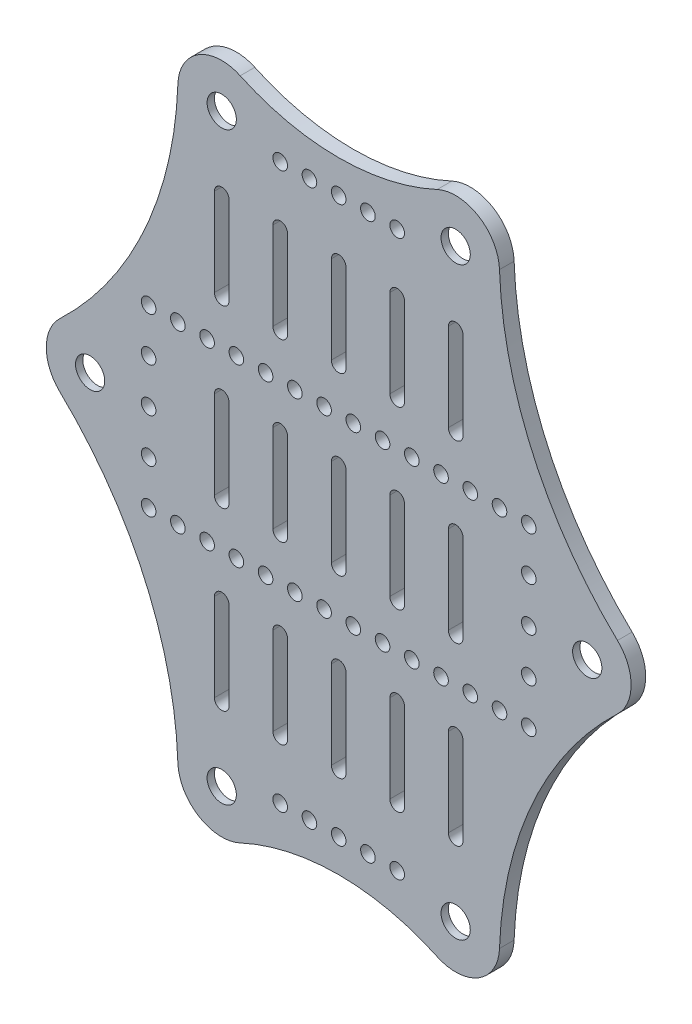
from build123d import *

# Parameters (mm, degrees)
BOSS_EXTRUDE1_DEPTH = 5
SKETCH2_R           = 5
CUT_EXTRUDE1_DEPTH  = 153.47950682
SKETCH5_R           = 2.5
CUT_EXTRUDE4_DEPTH  = 12.5
CUT_EXTRUDE5_DEPTH  = 10
SKETCH7_R           = 2.5
CUT_EXTRUDE6_DEPTH  = 10
SKETCH8_R           = 2.5
CUT_EXTRUDE7_DEPTH  = 10
SKETCH9_R           = 8.75
CUT_EXTRUDE8_DEPTH  = 2.5


with BuildPart() as part:
    # Sketch1 → Boss-Extrude1 (new body)
    with BuildSketch(Plane.XY):
        with BuildLine():
            ThreePointArc((95.335601491, -10.870848257), (100, 0), (95.335601491, 10.870848257))
            ThreePointArc((95.335601491, 10.870848257), (66.361018737, 51.737458432), (54.990773904, 100.526020671))
            ThreePointArc((54.990773904, 100.526020671), (47.847440062, 112.783492655), (33.684210526, 113.60554311))
            ThreePointArc((33.684210526, 113.60554311), (0, 106.168439698), (-33.684210526, 113.60554311))
            ThreePointArc((-33.684210526, 113.60554311), (-47.847440062, 112.783492655), (-54.990773904, 100.526020671))
            ThreePointArc((-54.990773904, 100.526020671), (-66.361018737, 51.737458432), (-95.335601491, 10.870848257))
            ThreePointArc((-95.335601491, 10.870848257), (-100, 0), (-95.335601491, -10.870848257))
            ThreePointArc((-95.335601491, -10.870848257), (-66.361018737, -51.737458432), (-54.990773904, -100.526020671))
            ThreePointArc((-54.990773904, -100.526020671), (-47.847440062, -112.783492655), (-33.684210526, -113.60554311))
            ThreePointArc((-33.684210526, -113.60554311), (0, -106.168439698), (33.684210526, -113.60554311))
            ThreePointArc((33.684210526, -113.60554311), (47.847440062, -112.783492655), (54.990773904, -100.526020671))
            ThreePointArc((54.990773904, -100.526020671), (66.361018737, -51.737458432), (95.335601491, -10.870848257))
        make_face()
    extrude(amount=BOSS_EXTRUDE1_DEPTH)

    # Sketch2 → Cut-Extrude1 (cut, through all)
    with BuildSketch(Plane(origin=(0, 0, 0), x_dir=(-1, 0, 0), z_dir=(0, 0, -1))):
        with Locations((-40, 100)):
            Circle(SKETCH2_R)
        with Locations((-85, 0)):
            Circle(SKETCH2_R)
        with Locations(Location((85, 0, 0), (0, 0, 180))):
            Circle(SKETCH2_R)
        with Locations(Location((40, 100, 0), (0, 0, 180))):
            Circle(SKETCH2_R)
        with Locations((40, -100)):
            Circle(SKETCH2_R)
        with Locations(Location((-40, -100, 0), (0, 0, 180))):
            Circle(SKETCH2_R)
    extrude(amount=-CUT_EXTRUDE1_DEPTH, mode=Mode.SUBTRACT)

    # Sketch5 → Cut-Extrude4 (cut)
    with BuildSketch(Plane(origin=(0, 0, 0), x_dir=(-1, 0, 0), z_dir=(0, 0, -1))):
        with Locations((20, 95)):
            Circle(SKETCH5_R)
        with Locations((0, 95)):
            Circle(SKETCH5_R)
        with Locations((10, 95)):
            Circle(SKETCH5_R)
        with Locations(Location((10, -95, 0), (0, 0, 180))):
            Circle(SKETCH5_R)
        with Locations(Location((0, -95, 0), (0, 0, 180))):
            Circle(SKETCH5_R)
        with Locations(Location((20, -95, 0), (0, 0, 180))):
            Circle(SKETCH5_R)
        with Locations(Location((-20, 95, 0), (0, 0, 180))):
            Circle(SKETCH5_R)
        with Locations(Location((-10, 95, 0), (0, 0, 180))):
            Circle(SKETCH5_R)
        with Locations((-20, -95)):
            Circle(SKETCH5_R)
        with Locations((-10, -95)):
            Circle(SKETCH5_R)
    extrude(amount=-CUT_EXTRUDE4_DEPTH, mode=Mode.SUBTRACT)

    # Sketch6 → Cut-Extrude5 (cut)
    with BuildSketch(Plane.XY.offset(5)):
        with BuildLine():
            Line((42.5, 75), (42.5, 45))
            ThreePointArc((42.5, 45), (40, 42.5), (37.5, 45))
            Line((37.5, 45), (37.5, 75))
            ThreePointArc((37.5, 75), (40, 77.5), (42.5, 75))
        make_face()
        with BuildLine():
            Line((22.5, 75), (22.5, 45))
            ThreePointArc((22.5, 45), (20, 42.5), (17.5, 45))
            Line((17.5, 45), (17.5, 75))
            ThreePointArc((17.5, 75), (20, 77.5), (22.5, 75))
        make_face()
        with BuildLine():
            Line((2.5, 75), (2.5, 45))
            ThreePointArc((2.5, 45), (0, 42.5), (-2.5, 45))
            Line((-2.5, 45), (-2.5, 75))
            ThreePointArc((-2.5, 75), (0, 77.5), (2.5, 75))
        make_face()
        with BuildLine():
            Line((-17.5, 75), (-17.5, 45))
            ThreePointArc((-17.5, 45), (-20, 42.5), (-22.5, 45))
            Line((-22.5, 45), (-22.5, 75))
            ThreePointArc((-22.5, 75), (-20, 77.5), (-17.5, 75))
        make_face()
        with BuildLine():
            Line((-37.5, 75), (-37.5, 45))
            ThreePointArc((-37.5, 45), (-40, 42.5), (-42.5, 45))
            Line((-42.5, 45), (-42.5, 75))
            ThreePointArc((-42.5, 75), (-40, 77.5), (-37.5, 75))
        make_face()
        with BuildLine():
            Line((42.5, 15), (42.5, -15))
            ThreePointArc((42.5, -15), (40, -17.5), (37.5, -15))
            Line((37.5, -15), (37.5, 15))
            ThreePointArc((37.5, 15), (40, 17.5), (42.5, 15))
        make_face()
        with BuildLine():
            Line((22.5, 15), (22.5, -15))
            ThreePointArc((22.5, -15), (20, -17.5), (17.5, -15))
            Line((17.5, -15), (17.5, 15))
            ThreePointArc((17.5, 15), (20, 17.5), (22.5, 15))
        make_face()
        with BuildLine():
            Line((2.5, 15), (2.5, -15))
            ThreePointArc((2.5, -15), (0, -17.5), (-2.5, -15))
            Line((-2.5, -15), (-2.5, 15))
            ThreePointArc((-2.5, 15), (0, 17.5), (2.5, 15))
        make_face()
        with BuildLine():
            Line((-17.5, 15), (-17.5, -15))
            ThreePointArc((-17.5, -15), (-20, -17.5), (-22.5, -15))
            Line((-22.5, -15), (-22.5, 15))
            ThreePointArc((-22.5, 15), (-20, 17.5), (-17.5, 15))
        make_face()
        with BuildLine():
            Line((-37.5, 15), (-37.5, -15))
            ThreePointArc((-37.5, -15), (-40, -17.5), (-42.5, -15))
            Line((-42.5, -15), (-42.5, 15))
            ThreePointArc((-42.5, 15), (-40, 17.5), (-37.5, 15))
        make_face()
        with BuildLine():
            Line((42.5, -45), (42.5, -75))
            ThreePointArc((42.5, -75), (40, -77.5), (37.5, -75))
            Line((37.5, -75), (37.5, -45))
            ThreePointArc((37.5, -45), (40, -42.5), (42.5, -45))
        make_face()
        with BuildLine():
            Line((22.5, -45), (22.5, -75))
            ThreePointArc((22.5, -75), (20, -77.5), (17.5, -75))
            Line((17.5, -75), (17.5, -45))
            ThreePointArc((17.5, -45), (20, -42.5), (22.5, -45))
        make_face()
        with BuildLine():
            Line((2.5, -45), (2.5, -75))
            ThreePointArc((2.5, -75), (0, -77.5), (-2.5, -75))
            Line((-2.5, -75), (-2.5, -45))
            ThreePointArc((-2.5, -45), (0, -42.5), (2.5, -45))
        make_face()
        with BuildLine():
            Line((-17.5, -45), (-17.5, -75))
            ThreePointArc((-17.5, -75), (-20, -77.5), (-22.5, -75))
            Line((-22.5, -75), (-22.5, -45))
            ThreePointArc((-22.5, -45), (-20, -42.5), (-17.5, -45))
        make_face()
        with BuildLine():
            Line((-37.5, -45), (-37.5, -75))
            ThreePointArc((-37.5, -75), (-40, -77.5), (-42.5, -75))
            Line((-42.5, -75), (-42.5, -45))
            ThreePointArc((-42.5, -45), (-40, -42.5), (-37.5, -45))
        make_face()
    extrude(amount=-CUT_EXTRUDE5_DEPTH, mode=Mode.SUBTRACT)

    # Sketch7 → Cut-Extrude6 (cut)
    with BuildSketch(Plane.XY.offset(5)):
        with Locations((-65, 30)):
            Circle(SKETCH7_R)
        with Locations((-55, 30)):
            Circle(SKETCH7_R)
        with Locations((-45, 30)):
            Circle(SKETCH7_R)
        with Locations((-35, 30)):
            Circle(SKETCH7_R)
        with Locations((-25, 30)):
            Circle(SKETCH7_R)
        with Locations((-15, 30)):
            Circle(SKETCH7_R)
        with Locations((-5, 30)):
            Circle(SKETCH7_R)
        with Locations((5, 30)):
            Circle(SKETCH7_R)
        with Locations((15, 30)):
            Circle(SKETCH7_R)
        with Locations((25, 30)):
            Circle(SKETCH7_R)
        with Locations((35, 30)):
            Circle(SKETCH7_R)
        with Locations((45, 30)):
            Circle(SKETCH7_R)
        with Locations((55, 30)):
            Circle(SKETCH7_R)
        with Locations((65, 30)):
            Circle(SKETCH7_R)
        with Locations((65, -30)):
            Circle(SKETCH7_R)
        with Locations((55, -30)):
            Circle(SKETCH7_R)
        with Locations((45, -30)):
            Circle(SKETCH7_R)
        with Locations((35, -30)):
            Circle(SKETCH7_R)
        with Locations((25, -30)):
            Circle(SKETCH7_R)
        with Locations((15, -30)):
            Circle(SKETCH7_R)
        with Locations((5, -30)):
            Circle(SKETCH7_R)
        with Locations((-5, -30)):
            Circle(SKETCH7_R)
        with Locations((-15, -30)):
            Circle(SKETCH7_R)
        with Locations((-25, -30)):
            Circle(SKETCH7_R)
        with Locations((-35, -30)):
            Circle(SKETCH7_R)
        with Locations((-45, -30)):
            Circle(SKETCH7_R)
        with Locations((-55, -30)):
            Circle(SKETCH7_R)
        with Locations((-65, -30)):
            Circle(SKETCH7_R)
    extrude(amount=-CUT_EXTRUDE6_DEPTH, mode=Mode.SUBTRACT)

    # Sketch8 → Cut-Extrude7 (cut)
    with BuildSketch(Plane.XY.offset(5)):
        with Locations((-65, 0)):
            Circle(SKETCH8_R)
        with Locations((-65, 15)):
            Circle(SKETCH8_R)
        with Locations((-65, -15)):
            Circle(SKETCH8_R)
        with Locations((65, -15)):
            Circle(SKETCH8_R)
        with Locations((65, 0)):
            Circle(SKETCH8_R)
        with Locations((65, 15)):
            Circle(SKETCH8_R)
    extrude(amount=-CUT_EXTRUDE7_DEPTH, mode=Mode.SUBTRACT)

    # Sketch9 → Cut-Extrude8 (cut)
    with BuildSketch(Plane(origin=(0, 0, 0), x_dir=(-1, 0, 0), z_dir=(0, 0, -1))):
        with Locations((85, 0)):
            Circle(SKETCH9_R)
        with Locations((40, 100)):
            Circle(SKETCH9_R)
        with Locations((40, -100)):
            Circle(SKETCH9_R)
        with Locations((-40, -100)):
            Circle(SKETCH9_R)
        with Locations((-85, 0)):
            Circle(SKETCH9_R)
        with Locations((-40, 100)):
            Circle(SKETCH9_R)
    extrude(amount=-CUT_EXTRUDE8_DEPTH, mode=Mode.SUBTRACT)


solid = part.part
